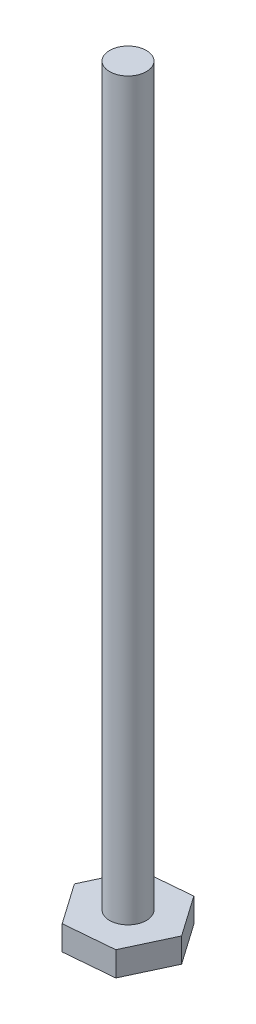
from build123d import *

# Parameters (mm, degrees)
BOSS_EXTRUDE1_DEPTH = 2
SKETCH2_R           = 1.5
BOSS_EXTRUDE2_DEPTH = 60


with BuildPart() as part:
    # Sketch1 → Boss-Extrude1 (new body)
    with BuildSketch(Plane(origin=(0, 0, 0), x_dir=(1, 0, 0), z_dir=(0, 1, 0))):
        Polygon((2.315895501, -3.312093199), (4.026304601, 0.349577737), (1.710409099, 3.661670936), (-2.315895501, 3.312093199), (-4.026304601, -0.349577737), (-1.710409099, -3.661670936), align=None)
    extrude(amount=BOSS_EXTRUDE1_DEPTH)

    # Sketch2 → Boss-Extrude2 (add)
    with BuildSketch(Plane(origin=(0, 2, 0), x_dir=(1, 0, 0), z_dir=(0, 1, 0))):
        with Locations(Location((0, 0, 0), (0, 0, 270))):
            Circle(SKETCH2_R)
    extrude(amount=BOSS_EXTRUDE2_DEPTH)


solid = part.part
